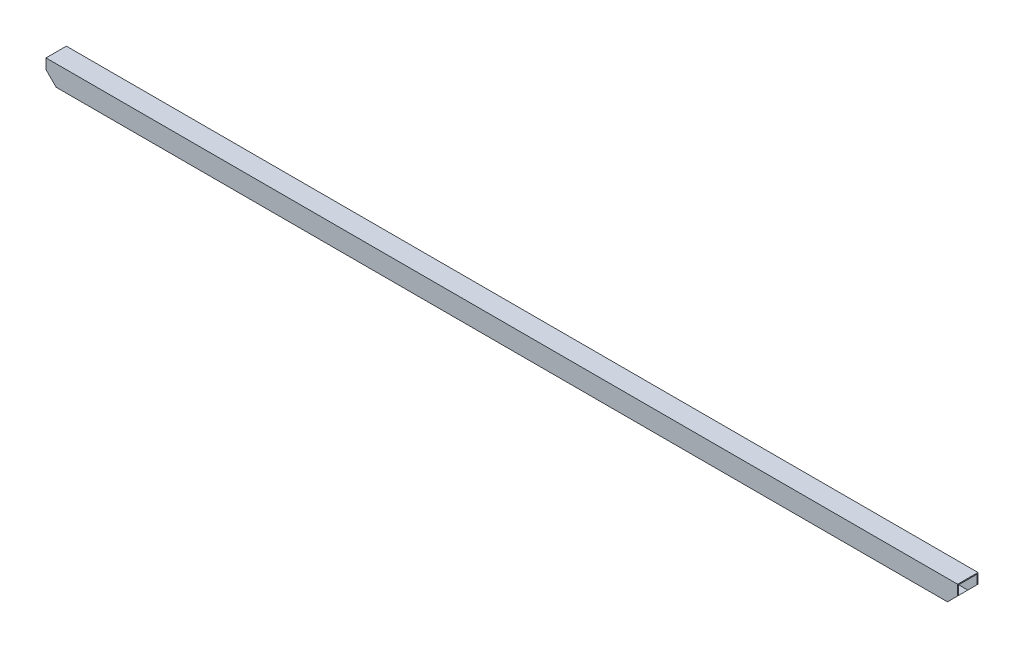
from build123d import *

# Parameters (mm, degrees)
BASE_W           = 1136.65
BASE_H           = 25.4
BOSS_FRAME_DEPTH = 25.4
SKETCH2_W        = 22.86
SKETCH2_H        = 22.86
CUT_HOLLOW_DEPTH = 1138.004693262
CUT_ANGLE_DEPTH  = 570.459064047


with BuildPart() as part:
    # Base → Boss-Frame (new body)
    with BuildSketch(Plane(origin=(0, 0, 0), x_dir=(1, 0, 0), z_dir=(0, 1, 0))):
        Rectangle(BASE_W, BASE_H)
    extrude(amount=BOSS_FRAME_DEPTH)

    # Sketch2 → Cut-Hollow (cut, through all)
    with BuildSketch(Plane(origin=(568.325, 0, 0), x_dir=(0, 0, -1), z_dir=(1, 0, 0))):
        with Locations((0, 12.7)):
            Rectangle(SKETCH2_W, SKETCH2_H)
    extrude(amount=-CUT_HOLLOW_DEPTH, mode=Mode.SUBTRACT)

    # Sketch4 → Cut-Angle (cut, through all)
    with BuildSketch(Plane.XY.offset(12.7)):
        Polygon((-568.325, 12.7), (-568.325, 0), (-555.645247213, 0), align=None)
        Polygon((568.325, 0), (555.645247213, 0), (568.325, 12.7), align=None)
    extrude(amount=-CUT_ANGLE_DEPTH, mode=Mode.SUBTRACT)


solid = part.part
